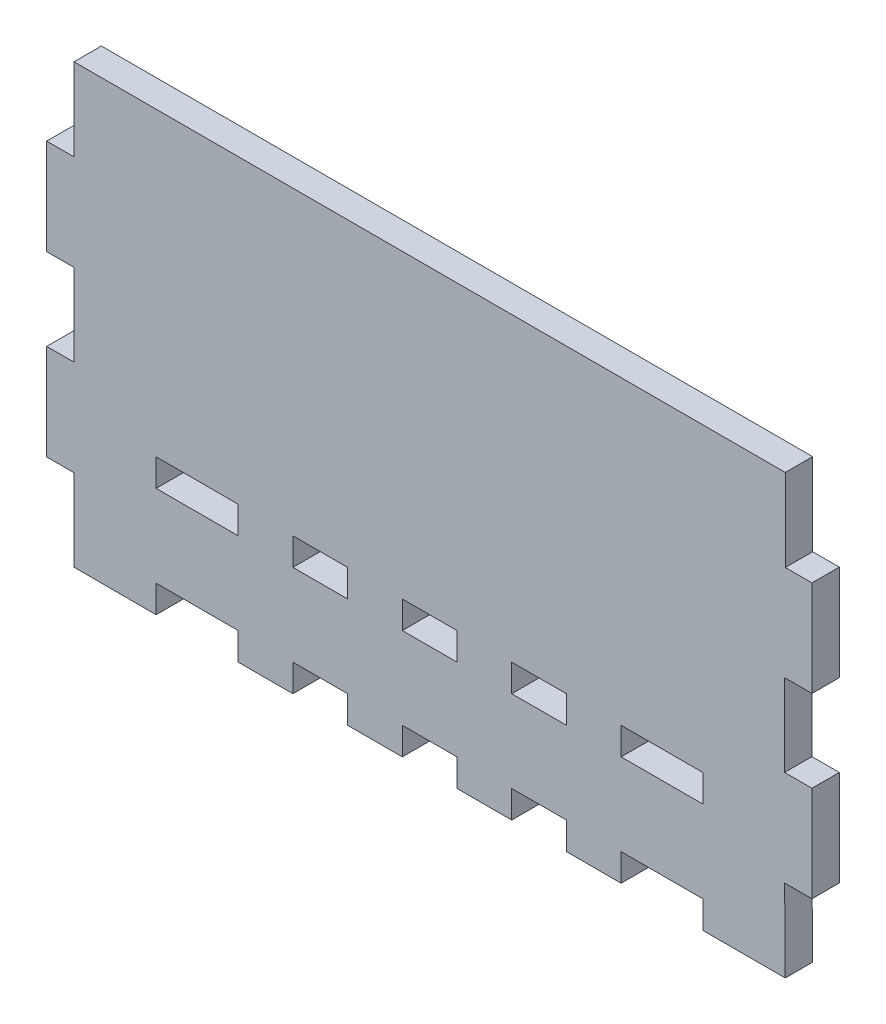
from build123d import *

# Parameters (mm, degrees)
SKETCH1_W           = 10
SKETCH1_H           = 5
SKETCH1_W_2         = 15
SKETCH1_W_3         = 14.993943351
BOSS_EXTRUDE2_DEPTH = 5


with BuildPart() as part:
    # Sketch1 → Boss-Extrude2 (new body)
    with BuildSketch(Plane.XY):
        Polygon((64.690886285, 24.89766958), (64.690886285, 39.946939566), (-65.309113715, 39.946939566), (-65.309113715, 24.89766958), (-70.309113715, 24.89766958), (-70.309113715, 7.39766958), (-65.309113715, 7.39766958), (-65.309113715, -7.60233042), (-70.309113715, -7.60233042), (-70.309113715, -25.10233042), (-65.309113715, -25.10233042), (-65.309113715, -40.053060434), (-50.309113715, -40.079299927), (-50.309113715, -35.079299927), (-35.309113715, -35.079299927), (-35.309113715, -40.079299927), (-25.309113715, -40.079299927), (-25.309113715, -35.079299927), (-15.309113715, -35.079299927), (-15.309113715, -40.079299927), (-5.309113715, -40.079299927), (-5.309113715, -35.079299927), (4.690886285, -35.079299927), (4.690886285, -40.079299927), (14.690886285, -40.079299927), (14.690886285, -35.079299927), (24.690886285, -35.079299927), (24.690886285, -40.079299927), (34.690886285, -40.079299927), (34.690886285, -35.079299927), (49.684829636, -35.079299927), (49.684829636, -40.079299927), (64.684829636, -40.079299927), (64.565827504, -25.10233042), (69.565827504, -25.10233042), (69.565827504, -7.60233042), (64.565827504, -7.60233042), (64.565827504, 7.39766958), (69.565827504, 7.39766958), (69.565827504, 24.89766958), align=None)
        with Locations((-0.309113715, -17.579299927)):
            Rectangle(SKETCH1_W, SKETCH1_H, mode=Mode.SUBTRACT)
        with Locations((-20.309113715, -17.579299927)):
            Rectangle(SKETCH1_W, SKETCH1_H, mode=Mode.SUBTRACT)
        with Locations((-42.809113715, -17.579299927)):
            Rectangle(SKETCH1_W_2, SKETCH1_H, mode=Mode.SUBTRACT)
        with Locations((42.187857961, -17.579299927)):
            Rectangle(SKETCH1_W_3, SKETCH1_H, mode=Mode.SUBTRACT)
        with Locations((19.690886285, -17.579299927)):
            Rectangle(SKETCH1_W, SKETCH1_H, mode=Mode.SUBTRACT)
    extrude(amount=BOSS_EXTRUDE2_DEPTH)


solid = part.part
